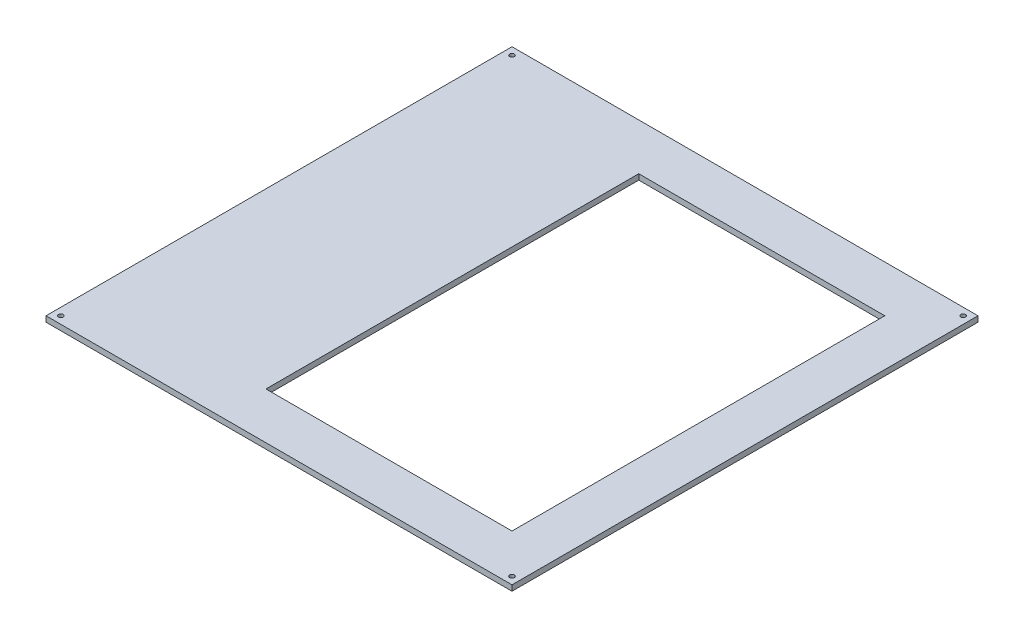
from build123d import *

# Parameters (mm, degrees)
SKETCH_1_W          = 250
SKETCH_1_H          = 250
EXTRUDE_1_DEPTH     = 3
SKETCH_3_W          = 132
SKETCH_3_H          = 200
CUT_EXTRUDE_1_DEPTH = 10
SKETCH_4_R          = 1.25
CUT_EXTRUDE_2_DEPTH = 10


with BuildPart() as part:
    # Эскиз1 → Бобышка-Вытянуть1 (new body)
    with BuildSketch(Plane(origin=(0, 0, 0), x_dir=(1, 0, 0), z_dir=(0, 1, 0))):
        Rectangle(SKETCH_1_W, SKETCH_1_H)
    extrude(amount=EXTRUDE_1_DEPTH)

    # Эскиз3 → Вырез-Вытянуть1 (cut)
    with BuildSketch(Plane.XZ):
        with Locations((34, 0)):
            Rectangle(SKETCH_3_W, SKETCH_3_H)
    extrude(amount=-CUT_EXTRUDE_1_DEPTH, mode=Mode.SUBTRACT)

    # Эскиз4 → Вырез-Вытянуть2 (cut)
    with BuildSketch(Plane.XZ):
        with Locations(Location((-121, 121, 0), (0, 0, 270))):
            Circle(SKETCH_4_R)
        with Locations(Location((121, 121, 0), (0, 0, 270))):
            Circle(SKETCH_4_R)
        with Locations(Location((121, -121, 0), (0, 0, 270))):
            Circle(SKETCH_4_R)
        with Locations(Location((-121, -121, 0), (0, 0, 270))):
            Circle(SKETCH_4_R)
    extrude(amount=-CUT_EXTRUDE_2_DEPTH, mode=Mode.SUBTRACT)


solid = part.part
